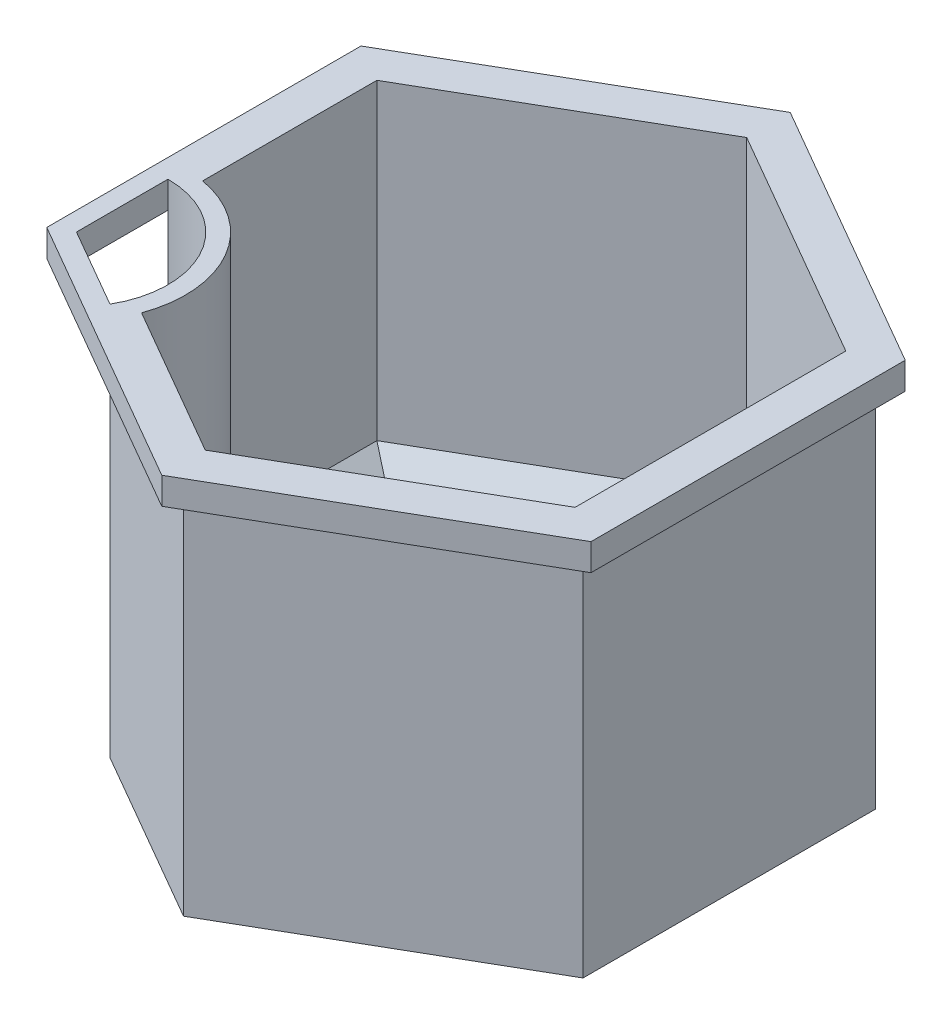
from build123d import *

# Parameters (mm, degrees)
BOSS_EXTRUDE1_DEPTH = 5
BOSS_EXTRUDE2_DEPTH = 73
CUT_EXTRUDE1_DEPTH  = 68
BOSS_EXTRUDE3_DEPTH = 73
CUT_EXTRUDE3_DEPTH  = 73
CHAMFER1_SIZE       = 10


with BuildPart() as part:
    # Sketch3 → Boss-Extrude1 (new body)
    with BuildSketch(Plane(origin=(0, 0, 0), x_dir=(1, 0, 0), z_dir=(0, 1, 0))):
        Polygon((50.577269222, -29.2008), (50.577269222, 29.2008), (0, 58.4016), (-50.577269222, 29.2008), (-50.577269222, -29.2008), (0, -58.4016), align=None)
        Polygon((43.577269222, -25.159348116), (43.577269222, 25.159348116), (0, 50.318696231), (-43.577269222, 25.159348116), (-43.577269222, -25.159348116), (0, -50.318696231), align=None, mode=Mode.SUBTRACT)
    extrude(amount=BOSS_EXTRUDE1_DEPTH)

    # Sketch4 → Boss-Extrude2 (add)
    with BuildSketch(Plane(origin=(0, 5, 0), x_dir=(1, 0, 0), z_dir=(0, 1, 0))):
        Polygon((47.077269222, -27.180074058), (47.077269222, 27.180074058), (0, 54.360148116), (-47.077269222, 27.180074058), (-47.077269222, -27.180074058), (0, -54.360148116), align=None)
    extrude(amount=-BOSS_EXTRUDE2_DEPTH)

    # Sketch5 → Cut-Extrude1 (cut)
    with BuildSketch(Plane(origin=(0, 5, 0), x_dir=(1, 0, 0), z_dir=(0, 1, 0))):
        Polygon((43.577269222, -25.159348116), (43.577269222, 25.159348116), (0, 50.318696231), (-43.577269222, 25.159348116), (-43.577269222, -25.159348116), (0, -50.318696231), align=None)
    extrude(amount=-CUT_EXTRUDE1_DEPTH, mode=Mode.SUBTRACT)

    # Sketch6 → Boss-Extrude3 (add)
    with BuildSketch(Plane(origin=(0, 5, 0), x_dir=(1, 0, 0), z_dir=(0, 1, 0))):
        with BuildLine():
            ThreePointArc((-28.017982948, -34.142506234), (-29.520182072, -17.058341723), (-43.577269222, -7.233700248))
            Line((-43.577269222, -7.233700248), (-43.577269222, -25.159348116))
            Line((-43.577269222, -25.159348116), (-28.017982948, -34.142506234))
        make_face()
    extrude(amount=-BOSS_EXTRUDE3_DEPTH)

    # Sketch9 → Cut-Extrude3 (cut)
    with BuildSketch(Plane(origin=(0, 5, 0), x_dir=(1, 0, 0), z_dir=(0, 1, 0))):
        with BuildLine():
            Line((-47.077269222, -10.180074058), (-47.077269222, -27.180074058))
            Line((-47.077269222, -27.180074058), (-32.354837357, -35.680074058))
            ThreePointArc((-32.354837357, -35.680074058), (-32.354837357, -18.680074058), (-47.077269222, -10.180074058))
        make_face()
    extrude(amount=-CUT_EXTRUDE3_DEPTH, mode=Mode.SUBTRACT)

    # Chamfer1
    chamfer1_edges = [part.edges().sort_by_distance(p)[0] for p in [
        (21.788634611, -63, 37.739022174),
        (-43.577269222, -63, -8.962823934),
        (-21.788634611, -63, -37.739022174),
        (21.788634611, -63, -37.739022174),
        (43.577269222, -63, 0),
        (-14.008991474, -63, 42.230601233),
    ]]
    chamfer(chamfer1_edges, length=CHAMFER1_SIZE)


solid = part.part
